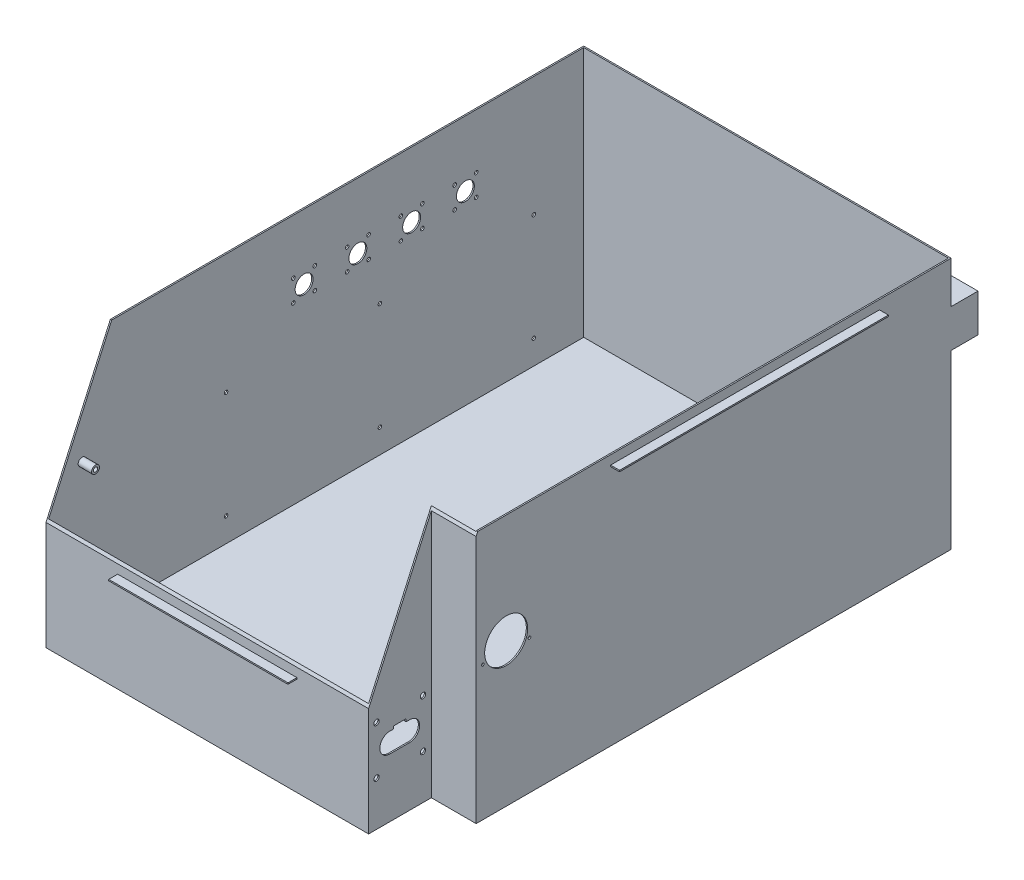
from build123d import *

# Parameters (mm, degrees)
BOSS_EXTRUDE1_DEPTH     = 1.5
BOSS_EXTRUDE2_DEPTH     = 280
SKETCH4_W               = 410
SKETCH4_H               = 42.385541564
BOSS_EXTRUDE3_DEPTH     = 30
CUT_EXTRUDE1_DEPTH      = 597.860327045
CUT_EXTRUDE1_DEPTH_BACK = 597.860327045
SKETCH8_R               = 4.39
SKETCH8_R_2             = 2.39
BOSS_EXTRUDE5_DEPTH     = 15
SKETCH10_R              = 3
CUT_EXTRUDE2_DEPTH      = 1.5
SKETCH15_W              = 15
SKETCH15_H              = 1.5
SKETCH15_W_2            = 20
BOSS_EXTRUDE6_DEPTH     = 13
BOSS_EXTRUDE7_DEPTH     = 1.5
BOSS_EXTRUDE8_DEPTH     = 1.5
SKETCH20_R              = 2.415919743
SKETCH20_R_2            = 2
CUT_EXTRUDE5_DEPTH      = 1.5
SKETCH5_R               = 2
SKETCH5_R_2             = 10
CUT_EXTRUDE7_DEPTH      = 1.5
SKETCH21_W              = 300
SKETCH21_H              = 1.5
BOSS_EXTRUDE9_DEPTH     = 10
SKETCH22_W              = 300
SKETCH22_H              = 1.5
BOSS_EXTRUDE10_DEPTH    = 10
BOSS_EXTRUDE11_DEPTH    = 0.75
BOSS_EXTRUDE12_DEPTH    = 0.75
BOSS_EXTRUDE13_DEPTH    = 0.75
BOSS_EXTRUDE14_DEPTH    = 0.75
SKETCH27_W              = 200
SKETCH27_H              = 1.5
BOSS_EXTRUDE15_DEPTH    = 10
BOSS_EXTRUDE16_DEPTH    = 0.75
BOSS_EXTRUDE17_DEPTH    = 0.75
SKETCH30_R              = 24
SKETCH30_R_2            = 1.5
CUT_EXTRUDE8_DEPTH      = 1.5
SKETCH33_R              = 2
CUT_EXTRUDE9_DEPTH      = 1.5


with BuildPart() as part:
    # Sketch1 → Boss-Extrude1 (new body)
    with BuildSketch(Plane(origin=(0, 0, 0), x_dir=(1, 0, 0), z_dir=(0, 1, 0))):
        Polygon((-205, 300), (205, 300), (205, -230), (155, -230), (155, -300), (-205, -300), align=None)
    extrude(amount=BOSS_EXTRUDE1_DEPTH)

    # Sketch2 → Boss-Extrude2 (add)
    with BuildSketch(Plane(origin=(0, 1.5, 0), x_dir=(1, 0, 0), z_dir=(0, 1, 0))):
        Polygon((-205, 300), (-205, -300), (155, -300), (155, -230), (205, -230), (205, 300), align=None)
        Polygon((-203.5, 298.5), (-203.5, -298.5), (153.5, -298.5), (153.5, -228.5), (203.5, -228.5), (203.5, 298.5), align=None, mode=Mode.SUBTRACT)
    extrude(amount=BOSS_EXTRUDE2_DEPTH)

    # Sketch4 → Boss-Extrude3 (add)
    with BuildSketch(Plane(origin=(0, 0, -300), x_dir=(-1, 0, 0), z_dir=(0, 0, -1))):
        with Locations((0, 213.483316708)):
            Rectangle(SKETCH4_W, SKETCH4_H)
    extrude(amount=BOSS_EXTRUDE3_DEPTH)

    # Sketch3 → Cut-Extrude1 (cut, two sides: drawn at the far end of the back side and taken through both)
    with BuildSketch(Plane.ZY.offset(205).offset(-CUT_EXTRUDE1_DEPTH_BACK)):
        Polygon((300, 121.117558148), (228.195222706, 281.5), (300, 281.5), align=None)
    extrude(amount=CUT_EXTRUDE1_DEPTH + CUT_EXTRUDE1_DEPTH_BACK, mode=Mode.SUBTRACT)

    # Sketch8 → Boss-Extrude5 (add)
    # profile 1 of 2: a face of its own
    with BuildSketch(Plane(origin=(-203.5, 0, 0), x_dir=(0, 0, -1), z_dir=(1, 0, 0))):
        with Locations((-261.240414508, 161.097837233)):
            Circle(SKETCH8_R)
        with Locations((-261.240414508, 161.097837233)):
            Circle(SKETCH8_R_2, mode=Mode.SUBTRACT)
    # profile 2 of 2: a face of its own
    with BuildSketch(Plane(origin=(-203.5, 0, 0), x_dir=(0, 0, -1), z_dir=(1, 0, 0))):
        with Locations((-203.5, 16.5)):
            Circle(SKETCH8_R)
        with Locations((-203.5, 16.5)):
            Circle(SKETCH8_R_2, mode=Mode.SUBTRACT)
    extrude(amount=BOSS_EXTRUDE5_DEPTH)

    # Sketch10 → Cut-Extrude2 (cut)
    with BuildSketch(Plane.ZY.offset(-153.5)):
        with BuildLine():
            Line((272.25, 90.5), (258.25, 90.5))
            Line((258.25, 90.5), (258.25, 87.5))
            Line((258.25, 87.5), (254, 87.5))
            ThreePointArc((254, 87.5), (243, 76.5), (254, 65.5))
            Line((254, 65.5), (276.5, 65.5))
            ThreePointArc((276.5, 65.5), (287.5, 76.5), (276.5, 87.5))
            Line((276.5, 87.5), (272.25, 87.5))
            Line((272.25, 87.5), (272.25, 90.5))
        make_face()
        with Locations((239.3, 103.45)):
            Circle(SKETCH10_R)
        with Locations((291.2, 103.45)):
            Circle(SKETCH10_R)
        with Locations((239.3, 49.55)):
            Circle(SKETCH10_R)
        with Locations((291.2, 49.55)):
            Circle(SKETCH10_R)
    extrude(amount=-CUT_EXTRUDE2_DEPTH, mode=Mode.SUBTRACT)

    # Sketch15 → Boss-Extrude6 (add)
    with BuildSketch(Plane.ZY.offset(-203.5)):
        with Locations((-206, 251.386283415)):
            Rectangle(SKETCH15_W, SKETCH15_H)
        with Locations((74.5, 251.386283415)):
            Rectangle(SKETCH15_W_2, SKETCH15_H)
    extrude(amount=BOSS_EXTRUDE6_DEPTH)

    # Sketch17 → Boss-Extrude7 (add)
    with BuildSketch(Plane.XY.offset(-198.5)):
        Polygon((203.5, 250.636283415), (203.5, 235.636283415), (190.5, 250.636283415), align=None)
    extrude(amount=-BOSS_EXTRUDE7_DEPTH)

    # Sketch18 → Boss-Extrude8 (add)
    with BuildSketch(Plane.XY.offset(64.5)):
        Polygon((203.5, 250.636283415), (203.5, 235.636283415), (190.5, 250.636283415), align=None)
    extrude(amount=BOSS_EXTRUDE8_DEPTH)

    # Sketch20 → Cut-Extrude5 (cut)
    with BuildSketch(Plane(origin=(0, 252.136283415, 0), x_dir=(1, 0, 0), z_dir=(0, 1, 0))):
        with Locations(Location((198, 206.5, 0), (0, 0, 270))):
            Circle(SKETCH20_R)
        with Locations(Location((200.5, -77.5, 0), (0, 0, 270))):
            Circle(SKETCH20_R_2)
    extrude(amount=-CUT_EXTRUDE5_DEPTH, mode=Mode.SUBTRACT)

    # Sketch5 → Cut-Extrude7 (cut)
    with BuildSketch(Plane.ZY.offset(205)):
        with Locations((-178.5, 220.666641665)):
            Circle(SKETCH5_R)
        with Locations((-154.5, 196.666641665)):
            Circle(SKETCH5_R)
        with Locations((-154.5, 220.666641665)):
            Circle(SKETCH5_R)
        with Locations((-166.5, 208.666641665)):
            Circle(SKETCH5_R_2)
        with Locations((-178.5, 196.666641665)):
            Circle(SKETCH5_R)
        with Locations((-118.5, 220.666641665)):
            Circle(SKETCH5_R)
        with Locations((-94.5, 196.666641665)):
            Circle(SKETCH5_R)
        with Locations((-94.5, 220.666641665)):
            Circle(SKETCH5_R)
        with Locations((-106.5, 208.666641665)):
            Circle(SKETCH5_R_2)
        with Locations((-118.5, 196.666641665)):
            Circle(SKETCH5_R)
        with Locations((-58.5, 220.666641665)):
            Circle(SKETCH5_R)
        with Locations((-34.5, 196.666641665)):
            Circle(SKETCH5_R)
        with Locations((-34.5, 220.666641665)):
            Circle(SKETCH5_R)
        with Locations((-46.5, 208.666641665)):
            Circle(SKETCH5_R_2)
        with Locations((-58.5, 196.666641665)):
            Circle(SKETCH5_R)
        with Locations((1.5, 220.666641665)):
            Circle(SKETCH5_R)
        with Locations((25.5, 196.666641665)):
            Circle(SKETCH5_R)
        with Locations((25.5, 220.666641665)):
            Circle(SKETCH5_R)
        with Locations((13.5, 208.666641665)):
            Circle(SKETCH5_R_2)
        with Locations((1.5, 196.666641665)):
            Circle(SKETCH5_R)
    extrude(amount=-CUT_EXTRUDE7_DEPTH, mode=Mode.SUBTRACT)

    # Sketch21 → Boss-Extrude9 (add)
    with BuildSketch(Plane(origin=(0, 0, -300), x_dir=(-1, 0, 0), z_dir=(0, 0, -1))):
        with Locations((0, 270.75)):
            Rectangle(SKETCH21_W, SKETCH21_H)
    extrude(amount=BOSS_EXTRUDE9_DEPTH)

    # Sketch22 → Boss-Extrude10 (add)
    with BuildSketch(Plane.ZY.offset(205)):
        with Locations((-70, 270.75)):
            Rectangle(SKETCH22_W, SKETCH22_H)
    boss_extrude10 = extrude(amount=BOSS_EXTRUDE10_DEPTH)

    # Sketch23 → Boss-Extrude11 (add, symmetric)
    with BuildSketch(Plane(origin=(0, 0, -140), x_dir=(-1, 0, 0), z_dir=(0, 0, -1))):
        Polygon((215, 270), (205, 270), (205, 260), align=None)
    boss_extrude11 = extrude(amount=BOSS_EXTRUDE11_DEPTH, both=True)

    # Sketch24 → Boss-Extrude12 (add, symmetric)
    with BuildSketch(Plane.XY.offset(-10)):
        Polygon((-215, 270), (-205, 260), (-205, 270), align=None)
    boss_extrude12 = extrude(amount=BOSS_EXTRUDE12_DEPTH, both=True)

    # Sketch25 → Boss-Extrude13 (add, symmetric)
    with BuildSketch(Plane(origin=(100, 0, 0), x_dir=(0, 0, -1), z_dir=(1, 0, 0))):
        Polygon((310, 270), (300, 270), (300, 260), align=None)
    extrude(amount=BOSS_EXTRUDE13_DEPTH, both=True)

    # Sketch26 → Boss-Extrude14 (add, symmetric)
    with BuildSketch(Plane.ZY.offset(100)):
        Polygon((-310, 270), (-300, 260), (-300, 270), align=None)
    extrude(amount=BOSS_EXTRUDE14_DEPTH, both=True)

    # Mirror1: Boss-Extrude10, Boss-Extrude11, Boss-Extrude12 across plane
    add(boss_extrude10.mirror(Plane(origin=(0, 0, 0), x_dir=(0, 0, 1), z_dir=(1, 0, 0))))
    add(boss_extrude11.mirror(Plane(origin=(0, 0, 0), x_dir=(0, 0, 1), z_dir=(1, 0, 0))))
    add(boss_extrude12.mirror(Plane(origin=(0, 0, 0), x_dir=(0, 0, 1), z_dir=(1, 0, 0))))

    # Sketch27 → Boss-Extrude15 (add)
    with BuildSketch(Plane.XY.offset(300)):
        with Locations((-25, 110.367558148)):
            Rectangle(SKETCH27_W, SKETCH27_H)
    extrude(amount=BOSS_EXTRUDE15_DEPTH)

    # Sketch28 → Boss-Extrude16 (add, symmetric)
    with BuildSketch(Plane.ZY.offset(95)):
        Polygon((310, 109.617558148), (300, 109.617558148), (300, 99.617558148), align=None)
    extrude(amount=BOSS_EXTRUDE16_DEPTH, both=True)

    # Sketch29 → Boss-Extrude17 (add, symmetric)
    with BuildSketch(Plane(origin=(45, 0, 0), x_dir=(0, 0, -1), z_dir=(1, 0, 0))):
        Polygon((-310, 109.617558148), (-300, 99.617558148), (-300, 109.617558148), align=None)
    extrude(amount=BOSS_EXTRUDE17_DEPTH, both=True)

    # Sketch30 → Cut-Extrude8 (cut)
    with BuildSketch(Plane(origin=(205, 0, 0), x_dir=(0, 0, -1), z_dir=(1, 0, 0))):
        with Locations((-196.5, 160)):
            Circle(SKETCH30_R)
        with Locations((-222.5, 150)):
            Circle(SKETCH30_R_2)
        with Locations((-170.5, 150)):
            Circle(SKETCH30_R_2)
    extrude(amount=-CUT_EXTRUDE8_DEPTH, mode=Mode.SUBTRACT)

    # Sketch33 → Cut-Extrude9 (cut)
    with BuildSketch(Plane.ZY.offset(205)):
        with Locations((-242.8, 147.77)):
            Circle(SKETCH33_R)
        with Locations((-242.8, 28.39)):
            Circle(SKETCH33_R)
        with Locations((-71.1, 147.77)):
            Circle(SKETCH33_R)
        with Locations((-71.1, 28.39)):
            Circle(SKETCH33_R)
        with Locations((100.6, 147.77)):
            Circle(SKETCH33_R)
        with Locations((100.6, 28.39)):
            Circle(SKETCH33_R)
    extrude(amount=-CUT_EXTRUDE9_DEPTH, mode=Mode.SUBTRACT)


solid = part.part
